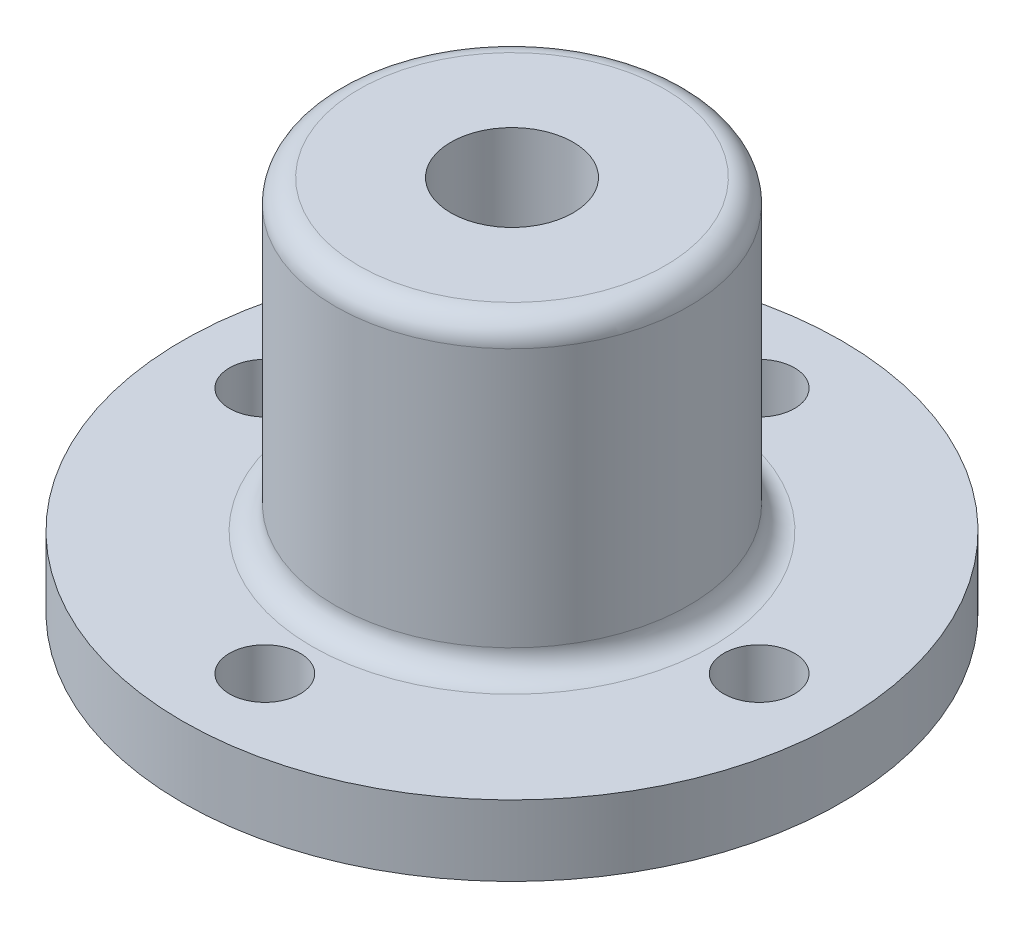
from build123d import *

# Parameters (mm, degrees)
SKETCH1_R           = 14
SKETCH1_R_2         = 1.5
BOSS_EXTRUDE1_DEPTH = 3
SKETCH2_R           = 7.5
BOSS_EXTRUDE2_DEPTH = 13
FILLET1_R           = 1
CUT_EXTRUDE2_START  = -6
SKETCH4_R           = 2.6
CUT_EXTRUDE2_DEPTH  = 6


with BuildPart() as part:
    # Sketch1 → Boss-Extrude1 (new body)
    with BuildSketch(Plane(origin=(0, 0, 0), x_dir=(1, 0, 0), z_dir=(0, 1, 0))):
        with Locations(Location((0, 0, 0), (0, 0, 270))):
            Circle(SKETCH1_R)
        with Locations(Location((0, 10.5, 0), (0, 0, 270))):
            Circle(SKETCH1_R_2, mode=Mode.SUBTRACT)
        with Locations(Location((10.5, 0, 0), (0, 0, 270))):
            Circle(SKETCH1_R_2, mode=Mode.SUBTRACT)
        with Locations(Location((0, -10.5, 0), (0, 0, 270))):
            Circle(SKETCH1_R_2, mode=Mode.SUBTRACT)
        with Locations(Location((-10.5, 0, 0), (0, 0, 270))):
            Circle(SKETCH1_R_2, mode=Mode.SUBTRACT)
        with BuildLine():
            Line((-2.35, 1.112429773), (-2.35, -1.112429773))
            ThreePointArc((-2.35, -1.112429773), (2.6, 0), (-2.35, 1.112429773))
        make_face(mode=Mode.SUBTRACT)
    extrude(amount=BOSS_EXTRUDE1_DEPTH)

    # Sketch2 → Boss-Extrude2 (add)
    with BuildSketch(Plane(origin=(0, 3, 0), x_dir=(1, 0, 0), z_dir=(0, 1, 0))):
        with Locations(Location((0, 0, 0), (0, 0, 90))):
            Circle(SKETCH2_R)
        with BuildLine():
            Line((-2.35, 1.112429773), (-2.35, -1.112429773))
            ThreePointArc((-2.35, -1.112429773), (2.6, 0), (-2.35, 1.112429773))
        make_face(mode=Mode.SUBTRACT)
    extrude(amount=BOSS_EXTRUDE2_DEPTH)

    # Fillet1
    fillet1_edges = [part.edges().sort_by_distance(p)[0] for p in [
        (0, 3, 7.5),
        (0, 16, 7.5),
    ]]
    fillet(fillet1_edges, radius=FILLET1_R)

    # Sketch4 → Cut-Extrude2 (cut)
    with BuildSketch(Plane(origin=(0, 16, 0), x_dir=(1, 0, 0), z_dir=(0, 1, 0)).offset(CUT_EXTRUDE2_START)):
        with Locations(Location((0, 0, 0), (0, 0, 154.668324983))):
            Circle(SKETCH4_R)
    extrude(amount=CUT_EXTRUDE2_DEPTH, mode=Mode.SUBTRACT)


solid = part.part
